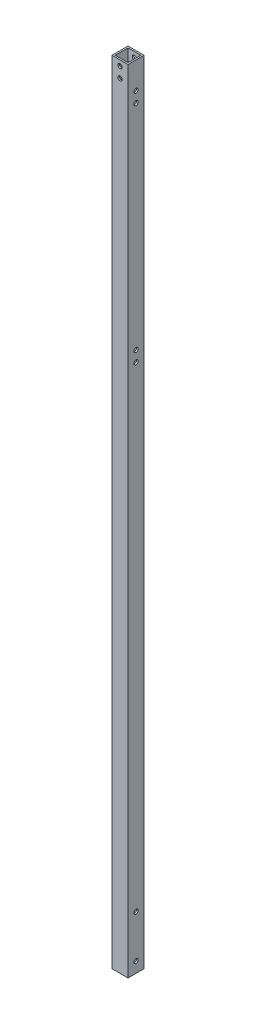
from build123d import *

# Parameters (mm, degrees)
SKETCH_1_W          = 15
SKETCH_1_H          = 15
SKETCH_1_W_2        = 12
SKETCH_1_H_2        = 12
EXTRUDE_1_DEPTH     = 740
SKETCH_2_R          = 2
CUT_EXTRUDE_1_DEPTH = 741.190009389
SKETCH_3_R          = 2
CUT_EXTRUDE_2_DEPTH = 741.190009389


with BuildPart() as part:
    # ｽｹｯﾁ1 → 押し出し-薄板1 (new body)
    with BuildSketch(Plane(origin=(0, 0, 0), x_dir=(1, 0, 0), z_dir=(0, 1, 0))):
        Rectangle(SKETCH_1_W, SKETCH_1_H)
        Rectangle(SKETCH_1_W_2, SKETCH_1_H_2, mode=Mode.SUBTRACT)
    extrude(amount=EXTRUDE_1_DEPTH)

    # ｽｹｯﾁ2 → ｶｯﾄ - 押し出し1 (cut, through all)
    with BuildSketch(Plane(origin=(7.5, 0, 0), x_dir=(0, 0, -1), z_dir=(1, 0, 0))):
        with Locations((0, 50)):
            Circle(SKETCH_2_R)
        with Locations((0, 10)):
            Circle(SKETCH_2_R)
        with Locations((0, 715)):
            Circle(SKETCH_2_R)
        with Locations((0, 705)):
            Circle(SKETCH_2_R)
        with Locations((0, 505)):
            Circle(SKETCH_2_R)
        with Locations((0, 495)):
            Circle(SKETCH_2_R)
    extrude(amount=-CUT_EXTRUDE_1_DEPTH, mode=Mode.SUBTRACT)

    # ｽｹｯﾁ3 → ｶｯﾄ - 押し出し2 (cut, through all)
    with BuildSketch(Plane.XY.offset(7.5)):
        with Locations((0, 735)):
            Circle(SKETCH_3_R)
        with Locations((0, 725)):
            Circle(SKETCH_3_R)
    extrude(amount=-CUT_EXTRUDE_2_DEPTH, mode=Mode.SUBTRACT)


solid = part.part
